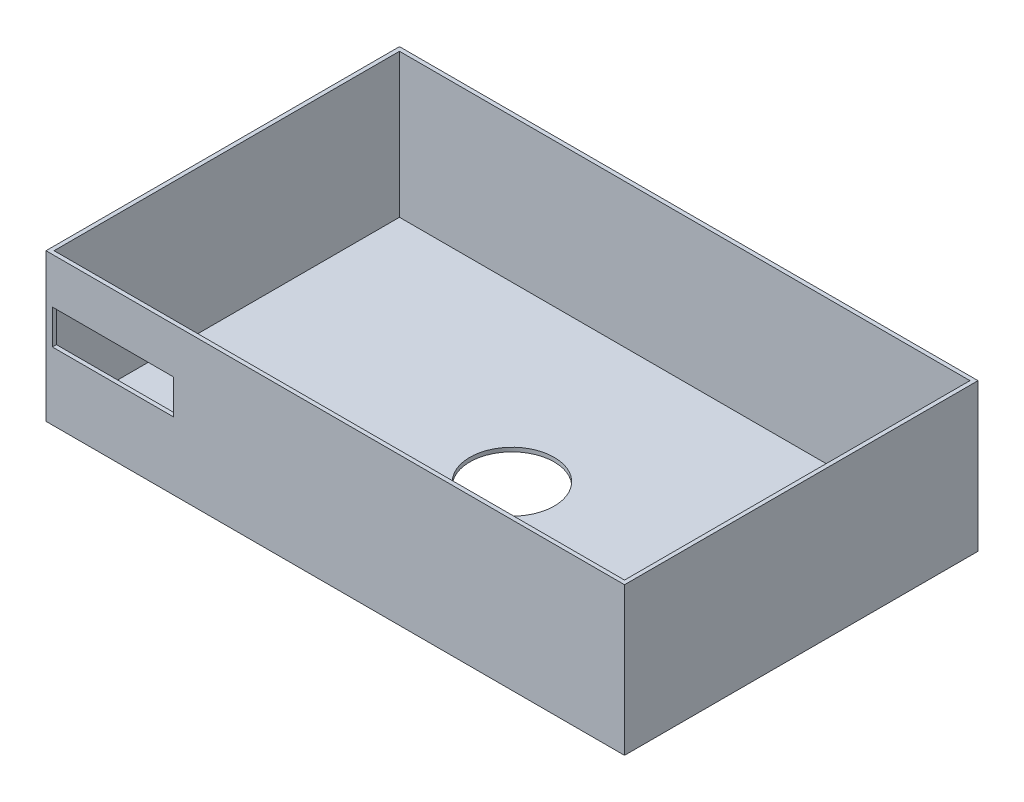
from build123d import *

# Parameters (mm, degrees)
SKETCH1_W           = 1370
SKETCH1_H           = 837.05
BOSS_EXTRUDE1_DEPTH = 350
SHELL1_T            = -9.525
SKETCH3_W           = 287.4
SKETCH3_H           = 82
CUT_EXTRUDE1_DEPTH  = 9.525
CUT_EXTRUDE2_REACH  = 1645.184
SKETCH7_R           = 100


with BuildPart() as part:
    # Sketch1 → Boss-Extrude1 (new body)
    with BuildSketch(Plane(origin=(0, 0, 0), x_dir=(1, 0, 0), z_dir=(0, 1, 0))):
        with Locations((685, 418.525)):
            Rectangle(SKETCH1_W, SKETCH1_H)
    extrude(amount=BOSS_EXTRUDE1_DEPTH)

    # Shell1
    shell1_openings = [part.faces().sort_by_distance(p)[0] for p in [
        (685, 350, -418.525),
    ]]
    offset(amount=SHELL1_T, openings=shell1_openings, kind=Kind.INTERSECTION)

    # Sketch3 → Cut-Extrude1 (cut)
    with BuildSketch(Plane.XY):
        with Locations((158.7, 201.1)):
            Rectangle(SKETCH3_W, SKETCH3_H)
    extrude(amount=-CUT_EXTRUDE1_DEPTH, mode=Mode.SUBTRACT)

    # Sketch7 → Cut-Extrude2 (cut, up to next)
    with BuildSketch(Plane.XZ, mode=Mode.PRIVATE) as cut_extrude2_sk1:
        with Locations(Location((685, -418.525, 0), (0, 0, 270))):
            Circle(SKETCH7_R)
    cut_extrude2_tool1 = extrude(cut_extrude2_sk1.sketch, amount=-CUT_EXTRUDE2_REACH, mode=Mode.PRIVATE) & part.part
    add(cut_extrude2_tool1.solids().sort_by_distance((685, 0, -418.525))[0], mode=Mode.SUBTRACT)


solid = part.part
